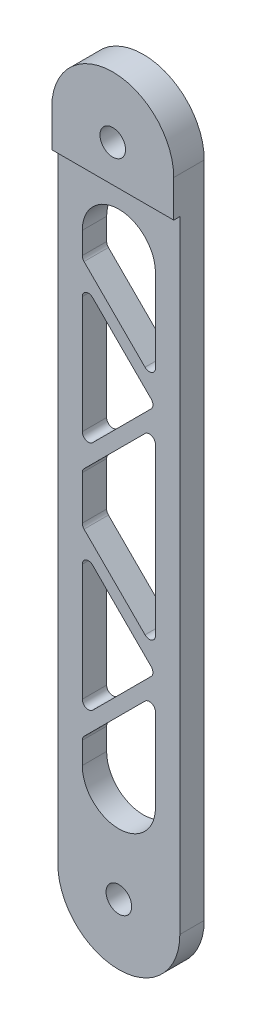
from build123d import *

# Parameters (mm, degrees)
CROQUIS1_R              = 2.1
SALIENTE_EXTRUIR1_DEPTH = 4
CROQUIS1_6_R            = 2.1
SALIENTE_EXTRUIR3_DEPTH = 5
REDONDEO1_R             = 1


with BuildPart() as part:
    # Croquis1 → Saliente-Extruir1 (new body)
    with BuildSketch(Plane.XY):
        with BuildLine():
            ThreePointArc((10, 54), (0, 64), (-10, 54))
            Line((-10, 54), (-10, -54))
            ThreePointArc((-10, -54), (0, -64), (10, -54))
            Line((10, -54), (10, 54))
        make_face()
        with Locations((0, 54)):
            Circle(CROQUIS1_R, mode=Mode.SUBTRACT)
        with BuildLine():
            Line((6, 38), (6, 22))
            Line((6, 22), (-6, 34))
            Line((-6, 34), (-6, 38))
            ThreePointArc((-6, 38), (0, 44), (6, 38))
        make_face(mode=Mode.SUBTRACT)
        Polygon((-6, 7), (-6, 31), (6, 19), align=None, mode=Mode.SUBTRACT)
        Polygon((-6, -4), (-6, 4), (6, 16), (6, -16), align=None, mode=Mode.SUBTRACT)
        Polygon((-6, -31), (-6, -7), (6, -19), align=None, mode=Mode.SUBTRACT)
        with BuildLine():
            Line((-6, -38), (-6, -34))
            Line((-6, -34), (6, -22))
            Line((6, -22), (6, -38))
            ThreePointArc((6, -38), (0, -44), (-6, -38))
        make_face(mode=Mode.SUBTRACT)
        with Locations((0, -54)):
            Circle(CROQUIS1_R, mode=Mode.SUBTRACT)
    extrude(amount=SALIENTE_EXTRUIR1_DEPTH)

    # Croquis1<6> → Saliente-Extruir3 (add)
    with BuildSketch(Plane.XY):
        with BuildLine():
            Line((10, 47.95), (10, 54))
            ThreePointArc((10, 54), (0, 64), (-10, 54))
            Line((-10, 54), (-10, 47.95))
            Line((-10, 47.95), (10, 47.95))
        make_face()
        with Locations((0, 54)):
            Circle(CROQUIS1_6_R, mode=Mode.SUBTRACT)
    extrude(amount=SALIENTE_EXTRUIR3_DEPTH)

    # Redondeo1
    redondeo1_edges = [part.edges().sort_by_distance(p)[0] for p in [
        (6, 22, 2),
        (6, 16, 2),
        (6, 19, 2),
        (-6, 31, 2),
        (-6, 7, 2),
        (6, -22, 2),
        (6, -16, 2),
        (6, -19, 2),
        (-6, -31, 2),
        (-6, -7, 2),
        (-6, 34, 2),
        (-6, -4, 2),
        (-6, -34, 2),
        (-6, 4, 2),
    ]]
    fillet(redondeo1_edges, radius=REDONDEO1_R)


solid = part.part
